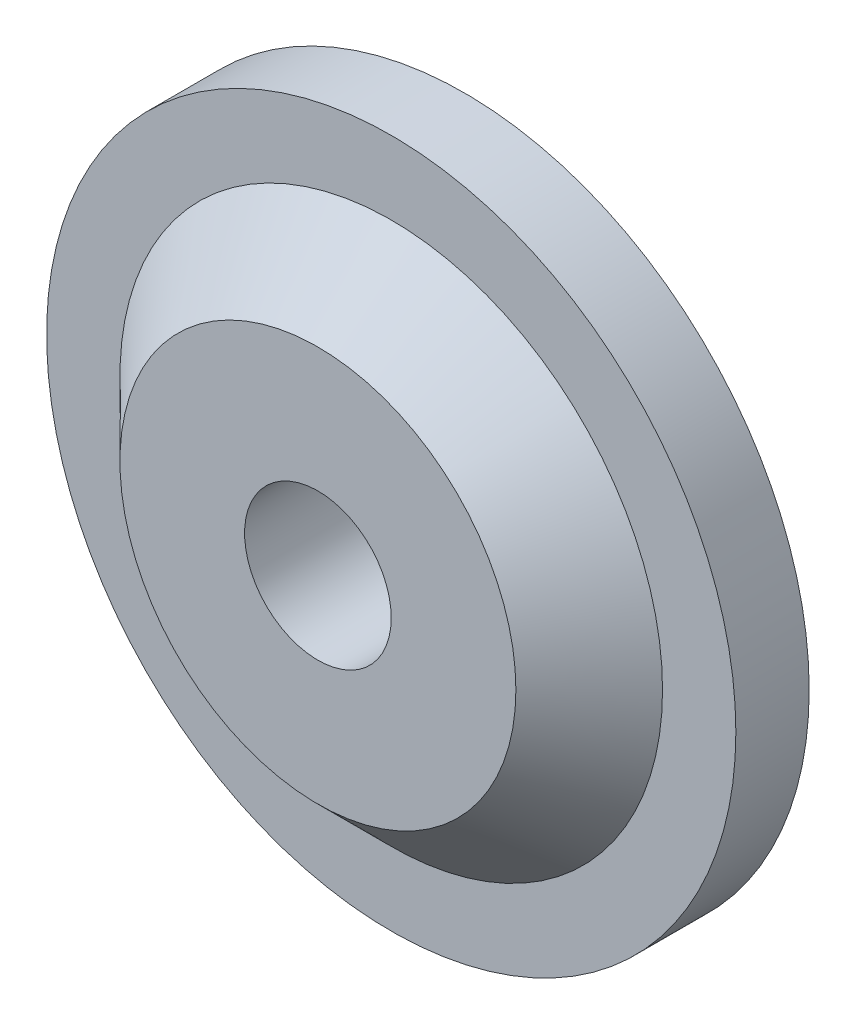
from build123d import *

# Parameters (mm, degrees)
SKETCH1_R           = 14.9225
SKETCH1_R_2         = 3.175
BOSS_EXTRUDE1_DEPTH = 6.35


with BuildPart() as part:
    # Sketch1 → Boss-Extrude1 (new body)
    with BuildSketch(Plane.XY):
        Circle(SKETCH1_R)
        Circle(SKETCH1_R_2, mode=Mode.SUBTRACT)
    extrude(amount=BOSS_EXTRUDE1_DEPTH)

    # Sketch2 → Cut-Revolve1 (revolve, cut)
    with BuildSketch(Plane(origin=(0, 0, 0), x_dir=(0, 0, -1), z_dir=(1, 0, 0)), mode=Mode.PRIVATE) as cut_revolve1_sk:
        Polygon((-6.35, 14.9225), (-3.175, 14.9225), (-3.175, 11.7475), (-6.35, 8.5725), align=None)
    revolve(cut_revolve1_sk.sketch.rotate(Axis((0, 0, 6.35), (0, 0, -1)), 90), axis=Axis((0, 0, 6.35), (0, 0, -1)), mode=Mode.SUBTRACT)


solid = part.part
